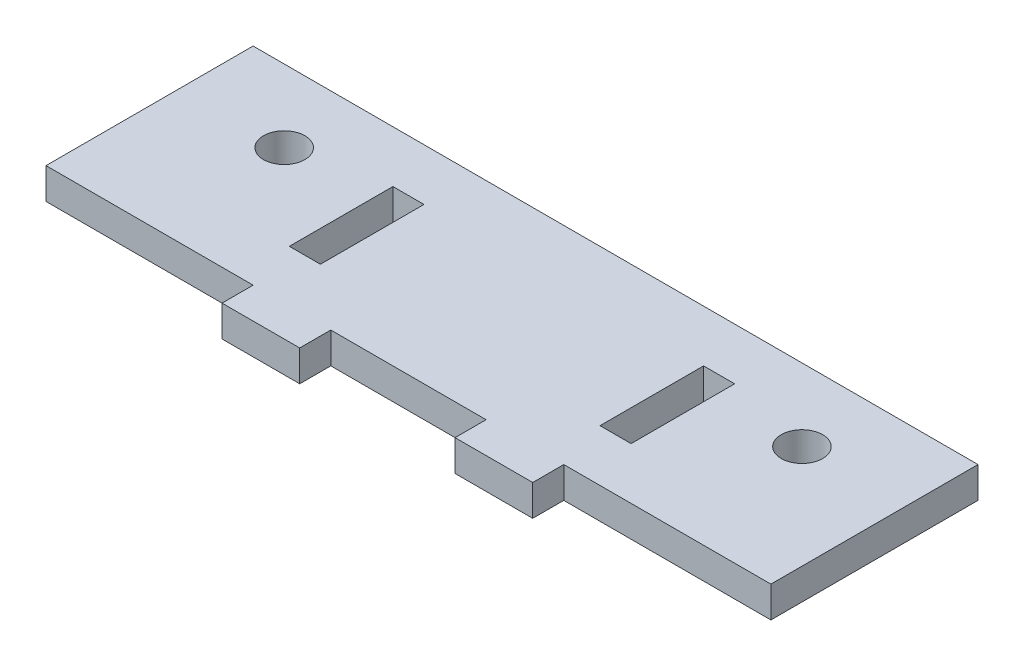
from build123d import *

# Parameters (mm, degrees)
SKETCH1_R           = 2
SKETCH1_W           = 3
SKETCH1_H           = 10
BOSS_EXTRUDE1_DEPTH = 3


with BuildPart() as part:
    # Sketch1 → Boss-Extrude1 (new body)
    with BuildSketch(Plane(origin=(0, 0, 0), x_dir=(1, 0, 0), z_dir=(0, 1, 0))):
        Polygon((0, 0), (20, 0), (20, -3), (27.5, -3), (27.5, 0), (42.5, 0), (42.5, -3), (50, -3), (50, 0), (70, 0), (70, 20), (0, 20), align=None)
        with Locations(Location((10, 13, 0), (0, 0, 270))):
            Circle(SKETCH1_R, mode=Mode.SUBTRACT)
        with Locations(Location((60, 13, 0), (0, 0, 90))):
            Circle(SKETCH1_R, mode=Mode.SUBTRACT)
        with Locations((20, 10)):
            Rectangle(SKETCH1_W, SKETCH1_H, mode=Mode.SUBTRACT)
        with Locations((50, 10)):
            Rectangle(SKETCH1_W, SKETCH1_H, mode=Mode.SUBTRACT)
    extrude(amount=BOSS_EXTRUDE1_DEPTH)


solid = part.part
